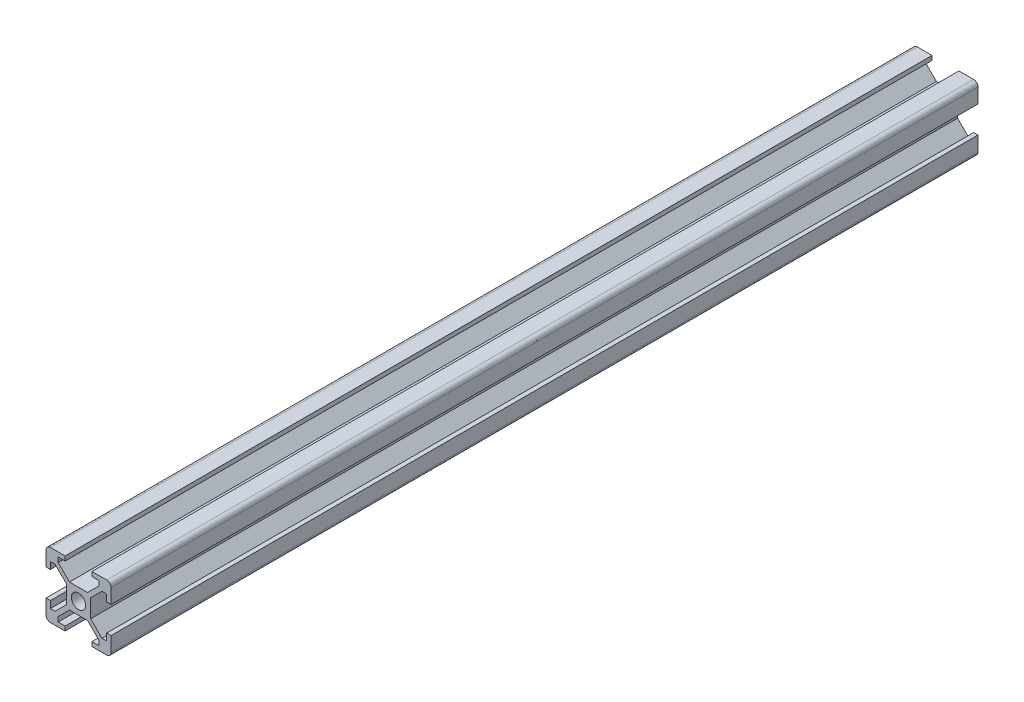
from build123d import *

# Parameters (mm, degrees)
SKETCH_2_R      = 1.65
EXTRUDE_1_DEPTH = 100


with BuildPart() as part:
    # 草图2 → 凸台-拉伸1 (new, symmetric)
    with BuildSketch(Plane.XY):
        with BuildLine():
            Line((-2.092893219, -2.8), (-4.7, -5.407106781))
            Line((-4.7, -5.407106781), (-4.7, -6.5))
            Line((-4.7, -6.5), (-3.1, -6.5))
            Line((-3.1, -6.5), (-3.1, -7.5))
            Line((-3.1, -7.5), (-6.5, -7.5))
            ThreePointArc((-6.5, -7.5), (-7.207106781, -7.207106781), (-7.5, -6.5))
            Line((-7.5, -6.5), (-7.5, -3.1))
            Line((-7.5, -3.1), (-6.5, -3.1))
            Line((-6.5, -3.1), (-6.5, -4.7))
            Line((-6.5, -4.7), (-5.407106781, -4.7))
            Line((-5.407106781, -4.7), (-2.8, -2.092893219))
            Line((-2.8, -2.092893219), (-2.8, 2.092893219))
            Line((-2.8, 2.092893219), (-5.407106781, 4.7))
            Line((-5.407106781, 4.7), (-6.5, 4.7))
            Line((-6.5, 4.7), (-6.5, 3.1))
            Line((-6.5, 3.1), (-7.5, 3.1))
            Line((-7.5, 3.1), (-7.5, 6.5))
            ThreePointArc((-7.5, 6.5), (-7.207106781, 7.207106781), (-6.5, 7.5))
            Line((-6.5, 7.5), (-3.1, 7.5))
            Line((-3.1, 7.5), (-3.1, 6.5))
            Line((-3.1, 6.5), (-4.7, 6.5))
            Line((-4.7, 6.5), (-4.7, 5.407106781))
            Line((-4.7, 5.407106781), (-2.092893219, 2.8))
            Line((-2.092893219, 2.8), (2.092893219, 2.8))
            Line((2.092893219, 2.8), (4.7, 5.407106781))
            Line((4.7, 5.407106781), (4.7, 6.5))
            Line((4.7, 6.5), (3.1, 6.5))
            Line((3.1, 6.5), (3.1, 7.5))
            Line((3.1, 7.5), (6.5, 7.5))
            ThreePointArc((6.5, 7.5), (7.207106781, 7.207106781), (7.5, 6.5))
            Line((7.5, 6.5), (7.5, 3.1))
            Line((7.5, 3.1), (6.5, 3.1))
            Line((6.5, 3.1), (6.5, 4.7))
            Line((6.5, 4.7), (5.407106781, 4.7))
            Line((5.407106781, 4.7), (2.8, 2.092893219))
            Line((2.8, 2.092893219), (2.8, -2.092893219))
            Line((2.8, -2.092893219), (5.407106781, -4.7))
            Line((5.407106781, -4.7), (6.5, -4.7))
            Line((6.5, -4.7), (6.5, -3.1))
            Line((6.5, -3.1), (7.5, -3.1))
            Line((7.5, -3.1), (7.5, -6.5))
            ThreePointArc((7.5, -6.5), (7.207106781, -7.207106781), (6.5, -7.5))
            Line((6.5, -7.5), (3.1, -7.5))
            Line((3.1, -7.5), (3.1, -6.5))
            Line((3.1, -6.5), (4.7, -6.5))
            Line((4.7, -6.5), (4.7, -5.407106781))
            Line((4.7, -5.407106781), (2.092893219, -2.8))
            Line((2.092893219, -2.8), (-2.092893219, -2.8))
        make_face()
        Circle(SKETCH_2_R, mode=Mode.SUBTRACT)
    extrude(amount=EXTRUDE_1_DEPTH, both=True)


solid = part.part
